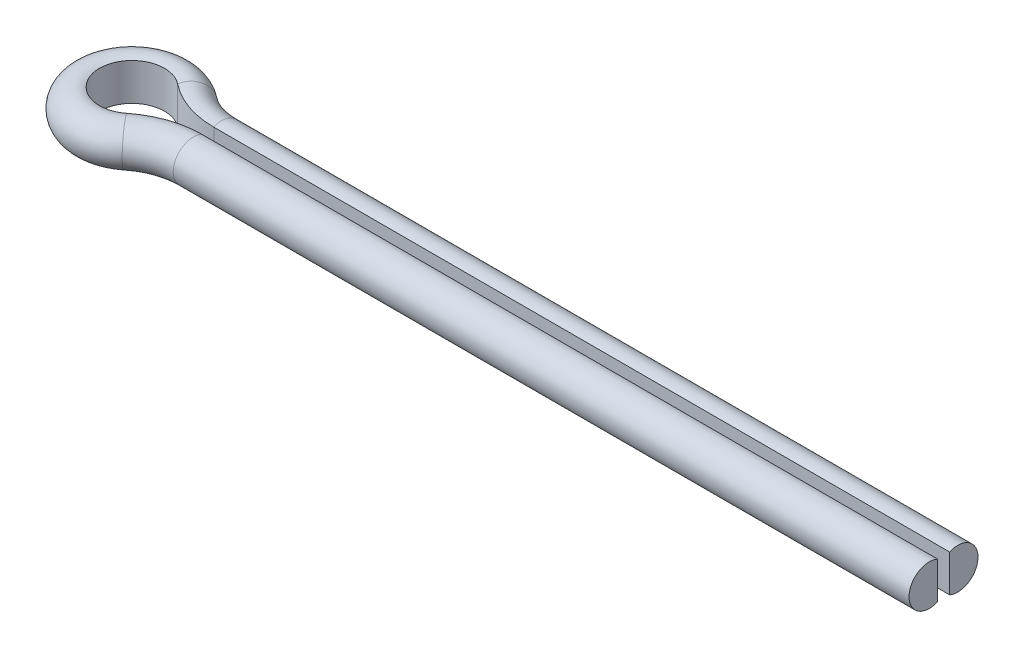
from build123d import *


with BuildPart() as part:
    # Sweep1: sweep along a path in Sketch1
    with BuildLine(Plane(origin=(0, 0, 0), x_dir=(1, 0, 0), z_dir=(0, 1, 0))) as sweep1_path:
        Line((100, 1.75), (9.324028099, 1.75))
        ThreePointArc((9.324028099, 1.75), (6.032625156, 2.307189684), (3.108009366, 3.916666667))
        ThreePointArc((3.108009366, 3.916666667), (-5, 0), (3.108009366, -3.916666667))
        ThreePointArc((3.108009366, -3.916666667), (6.032625156, -2.307189684), (9.324028099, -1.75))
        Line((9.324028099, -1.75), (100, -1.75))
    # Sketch2 → Sweep1 (sweep)
    with BuildSketch(Plane(origin=(100, 0, -1.75), x_dir=(0, 0, -1), z_dir=(1, 0, 0))):
        with BuildLine():
            Line((-1, -2.291287847), (-1, 2.291287847))
            ThreePointArc((-1, 2.291287847), (2.5, 0), (-1, -2.291287847))
        make_face()
    sweep(path=sweep1_path.line)


solid = part.part
